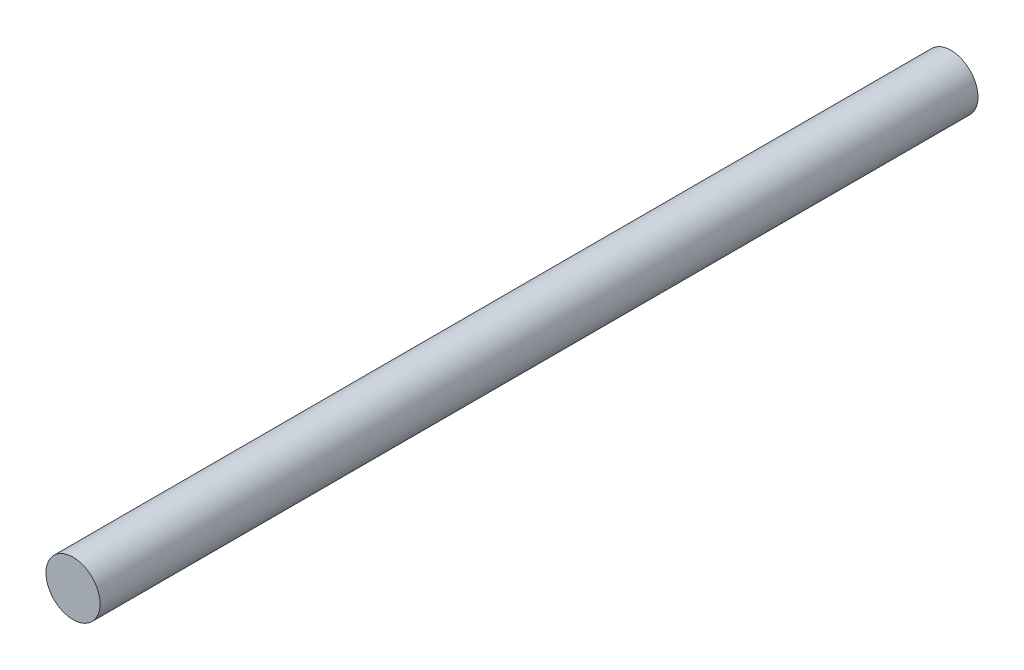
from build123d import *

# Parameters (mm, degrees)
SKETCH_1_R      = 6
EXTRUDE_1_DEPTH = 97.3


with BuildPart() as part:
    # Эскиз1 → Бобышка-Вытянуть1 (new body)
    with BuildSketch(Plane.XY):
        Circle(SKETCH_1_R)
    extrude(amount=EXTRUDE_1_DEPTH)

    # Зеркальное отражение1: part across plane


with BuildPart() as part_1:
    add(part.part)
    add(part.part.mirror(Plane.XY))


solid = part_1.part
